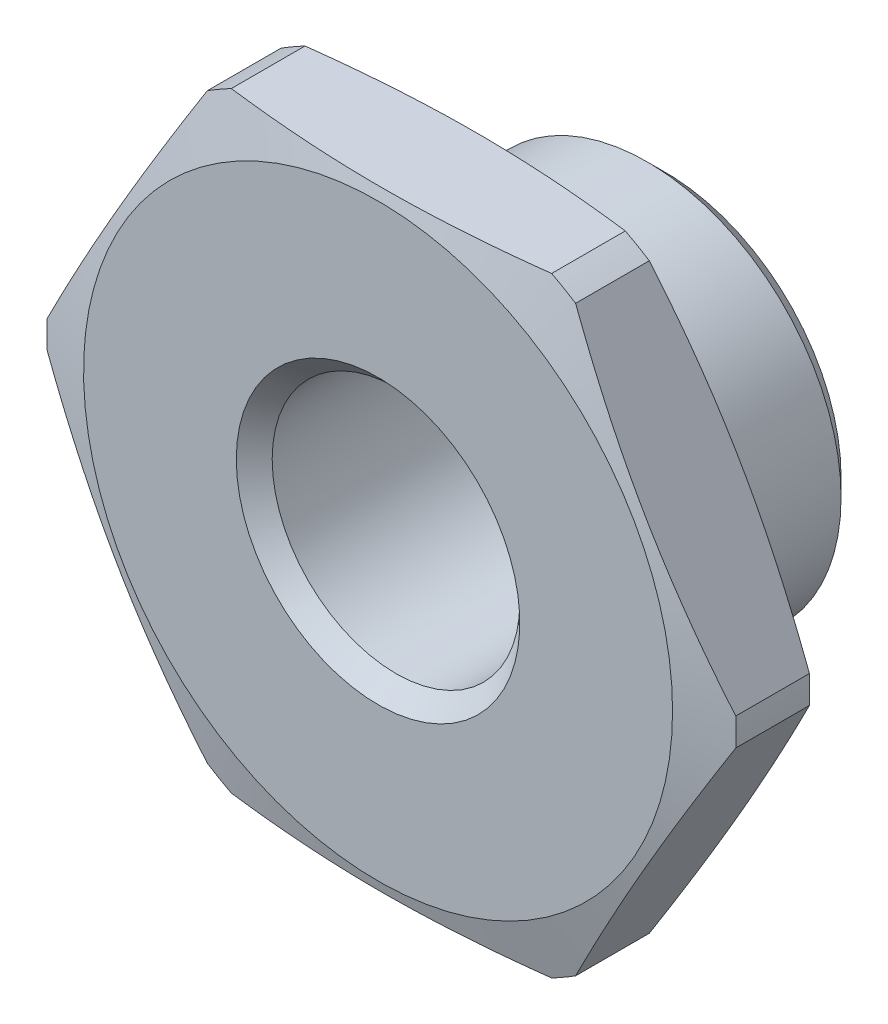
from build123d import *

# Parameters (mm, degrees)
SKETCH2_OUTSIDE_W  = 26.862
SKETCH2_OUTSIDE_H  = 26.862
CUT_EXTRUDE1_DEPTH = 10
CHAMFER1_SIZE      = 0.5


with BuildPart() as part:
    # Sketch1 → Revolve1 (revolve)
    with BuildSketch(Plane(origin=(0, 0, 0), x_dir=(0, 0, -1), z_dir=(1, 0, 0)), mode=Mode.PRIVATE) as revolve1_sk:
        Polygon((0, 3.45), (0, 8.205420274), (0.373676511, 9.6), (2.426323489, 9.6), (2.8, 8.205420274), (2.8, 4.7), (4.2, 4.7), (4.2, 5.4), (7.5, 5.4), (8, 4.9), (8, 3.45), align=None)
    revolve(revolve1_sk.sketch.rotate(Axis((0, 0, 0), (0, 0, -1)), 90), axis=Axis((0, 0, 0), (0, 0, -1)))

    # Sketch2 outside → Cut-Extrude1 (cut)
    with BuildSketch(Plane.XY):
        Rectangle(SKETCH2_OUTSIDE_W, SKETCH2_OUTSIDE_H)
        Polygon((9.814954576, 0), (4.907477288, 8.5), (-4.907477288, 8.5), (-9.814954576, 0), (-4.907477288, -8.5), (4.907477288, -8.5), align=None, mode=Mode.SUBTRACT)
    extrude(amount=-CUT_EXTRUDE1_DEPTH, mode=Mode.SUBTRACT)

    # Chamfer1
    chamfer1_edges = [part.edges().sort_by_distance(p)[0] for p in [
        (-3.45, 0, 0),
        (-3.45, 0, -8),
    ]]
    chamfer(chamfer1_edges, length=CHAMFER1_SIZE)


solid = part.part
